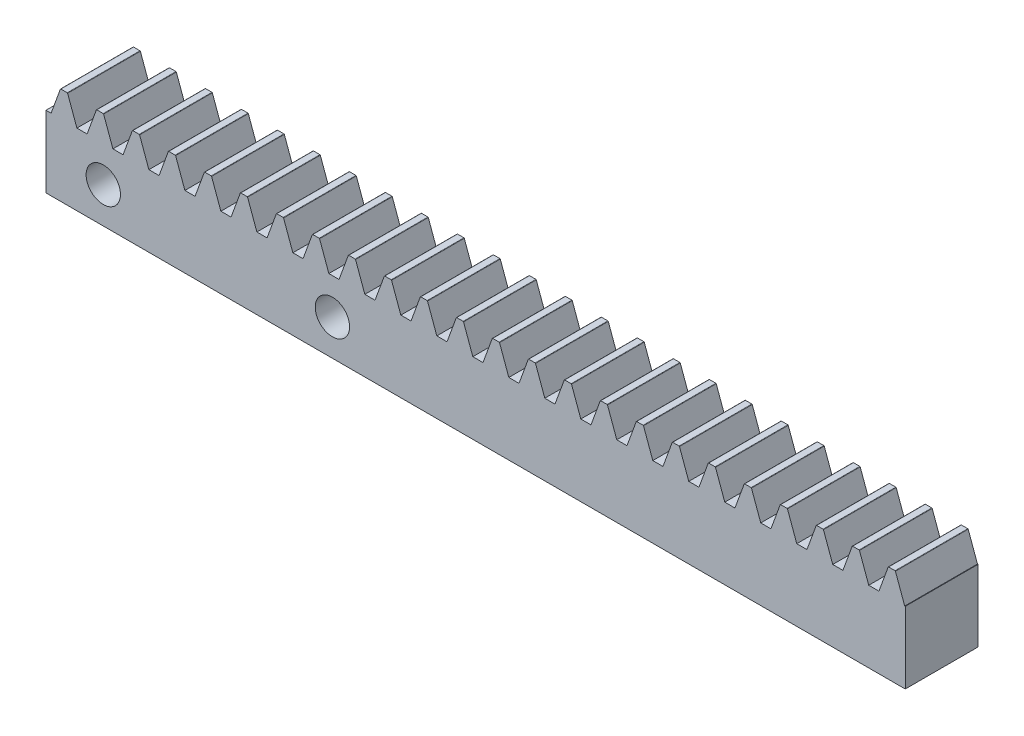
from build123d import *

# Parameters (mm, degrees)
BLANKSKE_W         = 75
BLANKSKE_H         = 8.5
BLANK_DEPTH        = 6.35
TOOTHCUTILL_DEPTH  = 76.746765608
TOOTHCUTSIM_DEPTH  = 76.746765608
TEETHCUTS_COUNT    = 25
TEETHCUTS_PITCH    = 3.14159265
SKETCH1_R          = 1.5
CUT_EXTRUDE1_DEPTH = 6.35


with BuildPart() as part:
    # BlankSke → Blank (new body)
    with BuildSketch(Plane.XY):
        with Locations((37.5, 4.25)):
            Rectangle(BLANKSKE_W, BLANKSKE_H)
    extrude(amount=-BLANK_DEPTH)

    # TooCutSkeIll → ToothCutIll (cut, through all)
    with BuildSketch(Plane.XY):
        with BuildLine():
            Line((-1.253788993, 8.473680806), (-0.504546125, 6.415152944))
            ThreePointArc((-0.504546125, 6.415152944), (-0.412650963, 6.295392837), (-0.268683278, 6.25))
            Line((-0.268683278, 6.25), (0.268683278, 6.25))
            ThreePointArc((0.268683278, 6.25), (0.412650963, 6.295392837), (0.504546125, 6.415152944))
            Line((0.504546125, 6.415152944), (1.253788993, 8.473680806))
            ThreePointArc((1.253788993, 8.473680806), (1.268433641, 8.492766082), (1.291376698, 8.5))
            Line((1.291376698, 8.5), (1.291376698, 8.5254))
            Line((1.291376698, 8.5254), (-1.291376698, 8.5254))
            Line((-1.291376698, 8.5254), (-1.291376698, 8.5))
            ThreePointArc((-1.291376698, 8.5), (-1.268433641, 8.492766082), (-1.253788993, 8.473680806))
        make_face()
    toothcutill = extrude(amount=-TOOTHCUTILL_DEPTH, mode=Mode.SUBTRACT)

    # TooCutSkeSim → ToothCutSim (cut, through all)
    with BuildSketch(Plane.XY):
        Polygon((0.44443537, 6.25), (-0.44443537, 6.25), (-1.272613241, 8.5254), (1.272613241, 8.5254), align=None)
    toothcutsim = extrude(amount=-TOOTHCUTSIM_DEPTH, mode=Mode.SUBTRACT)

    # TeethCuts: ToothCutIll, ToothCutSim ×25
    with Locations(*[(i * TEETHCUTS_PITCH, 0, 0) for i in range(1, TEETHCUTS_COUNT)]):
        add(toothcutill, mode=Mode.SUBTRACT)
        add(toothcutsim, mode=Mode.SUBTRACT)

    # Sketch1 → Cut-Extrude1 (cut)
    with BuildSketch(Plane.XY):
        with Locations((5, 3.125)):
            Circle(SKETCH1_R)
        with Locations((25, 3.125)):
            Circle(SKETCH1_R)
    extrude(amount=-CUT_EXTRUDE1_DEPTH, mode=Mode.SUBTRACT)


solid = part.part
